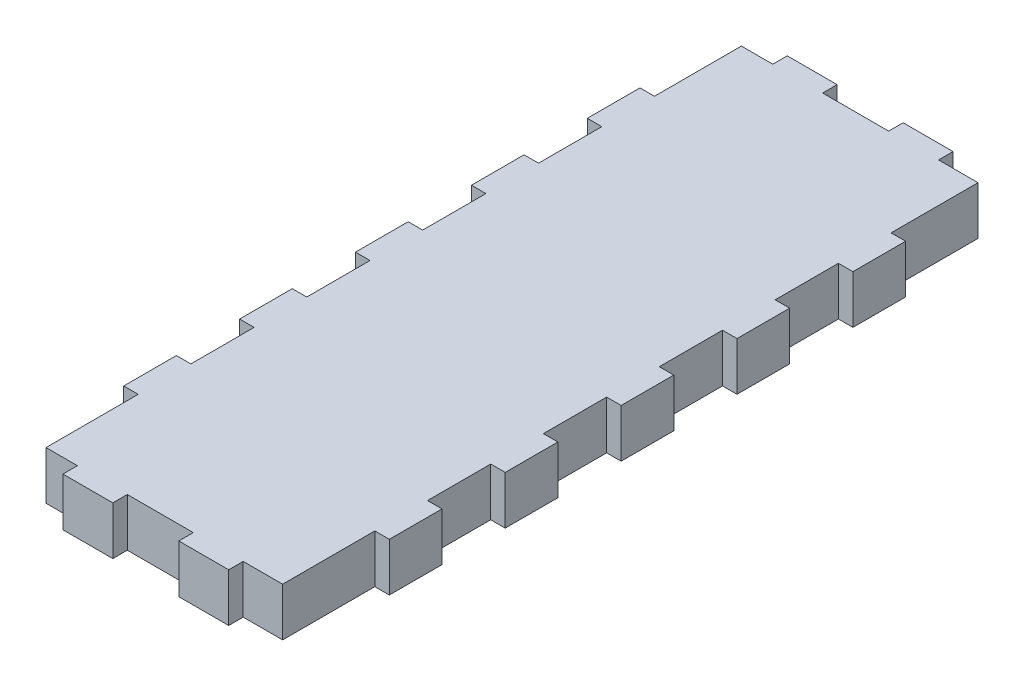
from build123d import *

# Parameters (mm, degrees)
BOSS_EXTRUDE1_DEPTH = 10


with BuildPart() as part:
    # Sketch1 → Boss-Extrude1 (new body)
    with BuildSketch(Plane(origin=(0, 0, 0), x_dir=(1, 0, 0), z_dir=(0, 1, 0))):
        Polygon((95.021896064, 122.703686357), (108.687087893, 122.703686357), (108.687087893, 125.703692436), (119.021899998, 125.703692436), (119.021899998, 122.703686357), (127.187088132, 122.703686357), (127.187088132, 104.703687131), (130.187094212, 104.703687131), (130.187094212, 93.799009919), (127.187088132, 93.799009919), (127.187088132, 80.703690648), (130.187094212, 80.703690648), (130.187094212, 69.799013436), (127.187088132, 69.799013436), (127.187088132, 56.703690439), (130.187094212, 56.703690439), (130.187094212, 45.799020678), (127.187088132, 45.799020678), (127.187088132, 32.703690231), (130.187094212, 32.703690231), (130.187094212, 21.799016744), (127.187088132, 21.799016744), (127.187088132, 8.703690022), (130.187094212, 8.703690022), (130.187094212, -2.200983232), (127.187088132, -2.200983232), (127.187088132, -21.29631117), (119.021899998, -21.29631117), (119.021899998, -24.296309799), (108.687087893, -24.296309799), (108.687087893, -21.29631117), (95.021896064, -21.29631117), (95.021896064, -24.296309799), (84.68709141, -24.296309799), (84.68709141, -21.29631117), (78.187085688, -21.29631117), (78.187085688, -2.200983232), (75.187087059, -2.200983232), (75.187087059, 8.703690022), (78.187085688, 8.703690022), (78.187085688, 21.799016744), (75.187087059, 21.799016744), (75.187087059, 32.703690231), (78.187085688, 32.703690231), (78.187085688, 45.799020678), (75.187087059, 45.799020678), (75.187087059, 56.703690439), (78.187085688, 56.703690439), (78.187085688, 69.799013436), (75.187087059, 69.799013436), (75.187087059, 80.703690648), (78.187085688, 80.703690648), (78.187085688, 93.799009919), (75.187087059, 93.799009919), (75.187087059, 104.703687131), (78.187085688, 104.703687131), (78.187085688, 122.703686357), (84.68709141, 122.703686357), (84.68709141, 125.703692436), (95.021896064, 125.703692436), align=None)
    extrude(amount=BOSS_EXTRUDE1_DEPTH)


solid = part.part
